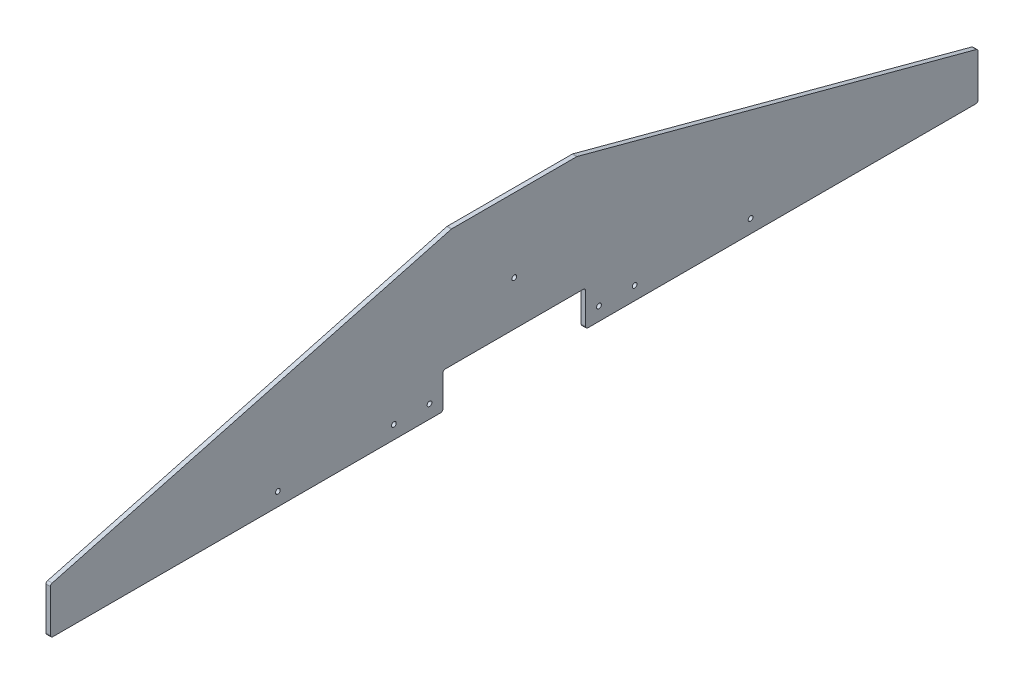
from build123d import *

# Parameters (mm, degrees)
BOSS_EXTRUDE1_DEPTH     = 6.35
SKETCH2_W               = 203.2
SKETCH2_H               = 50.8
CUT_EXTRUDE1_DEPTH      = 696.81774778
F_1_4_CLEARANCE_HOLE1_D = 6.7564
FILLET1_R               = 3.302


with BuildPart() as part:
    # Sketch1 → Boss-Extrude1 (new body)
    with BuildSketch(Plane(origin=(0, 0, 0), x_dir=(0, 0, -1), z_dir=(1, 0, 0))):
        Polygon((89.265604664, 219.075), (-89.265604664, 219.075), (-660.4, 66.04), (-660.4, 0), (660.4, 0), (660.4, 66.04), align=None)
    extrude(amount=BOSS_EXTRUDE1_DEPTH)

    # Sketch2 → Cut-Extrude1 (cut, through all)
    with BuildSketch(Plane(origin=(6.35, 0, 0), x_dir=(0, 0, -1), z_dir=(1, 0, 0))):
        with Locations((0, 25.4)):
            Rectangle(SKETCH2_W, SKETCH2_H)
    extrude(amount=-CUT_EXTRUDE1_DEPTH, mode=Mode.SUBTRACT)

    # 1/4 Clearance Hole1 (through all)
    with Locations(Plane.ZY):
        with Locations((-336.55, 19.05), (-120.65, 19.05), (120.65, 19.05), (336.55, 19.05), (0, 114.3), (-171.45, 19.05), (171.45, 19.05)):
            Hole(F_1_4_CLEARANCE_HOLE1_D / 2)

    # Fillet1
    fillet1_edges = [part.edges().sort_by_distance(p)[0] for p in [
        (3.175, 66.04, 660.4),
        (3.175, 219.075, 89.265604664),
        (3.175, 219.075, -89.265604664),
        (3.175, 66.04, -660.4),
        (3.175, 0, -660.4),
        (3.175, 0, 660.4),
        (3.175, 0, -101.6),
        (3.175, 0, 101.6),
        (3.175, 50.8, 101.6),
        (3.175, 50.8, -101.6),
    ]]
    fillet(fillet1_edges, radius=FILLET1_R)


solid = part.part
